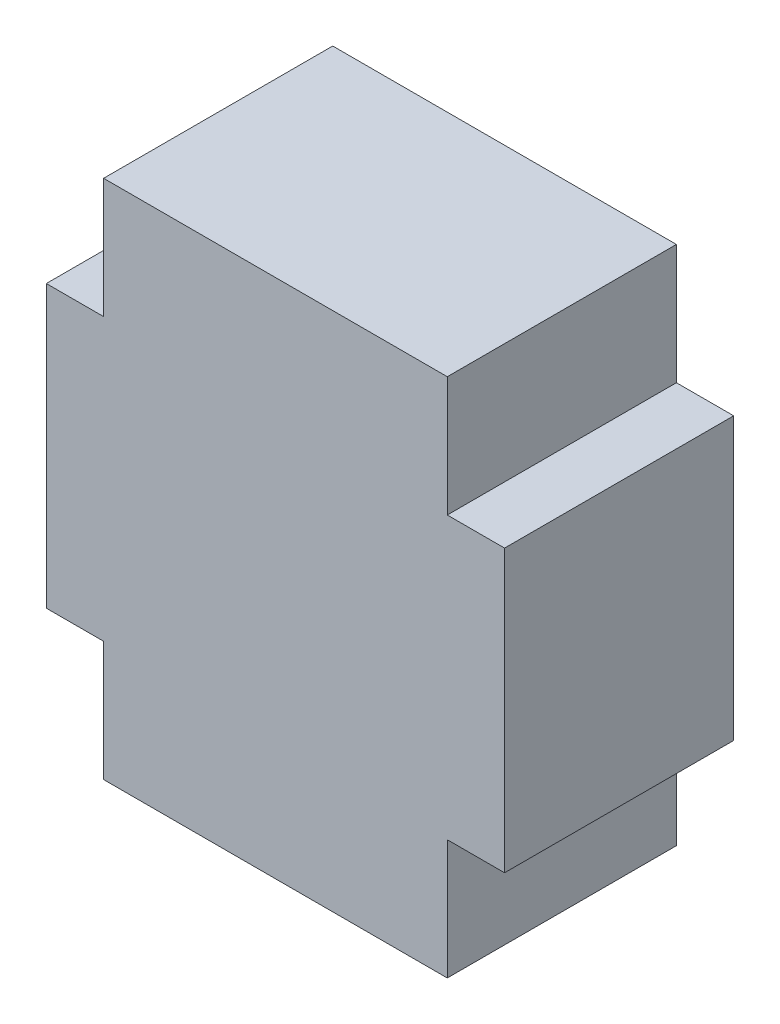
from build123d import *

# Parameters (mm, degrees)
COMPONENT_OUTLINE_DEPTH = 1.1


with BuildPart() as part:
    # 草图1 → Component_Outline (new body)
    with BuildSketch(Plane.XY):
        Polygon((1.1, -0.675), (0.825, -0.675), (0.825, -1.25), (-0.825, -1.25), (-0.825, -0.675), (-1.1, -0.675), (-1.1, 0.675), (-0.825, 0.675), (-0.825, 1.25), (0.825, 1.25), (0.825, 0.675), (1.1, 0.675), align=None)
    extrude(amount=COMPONENT_OUTLINE_DEPTH)


solid = part.part
